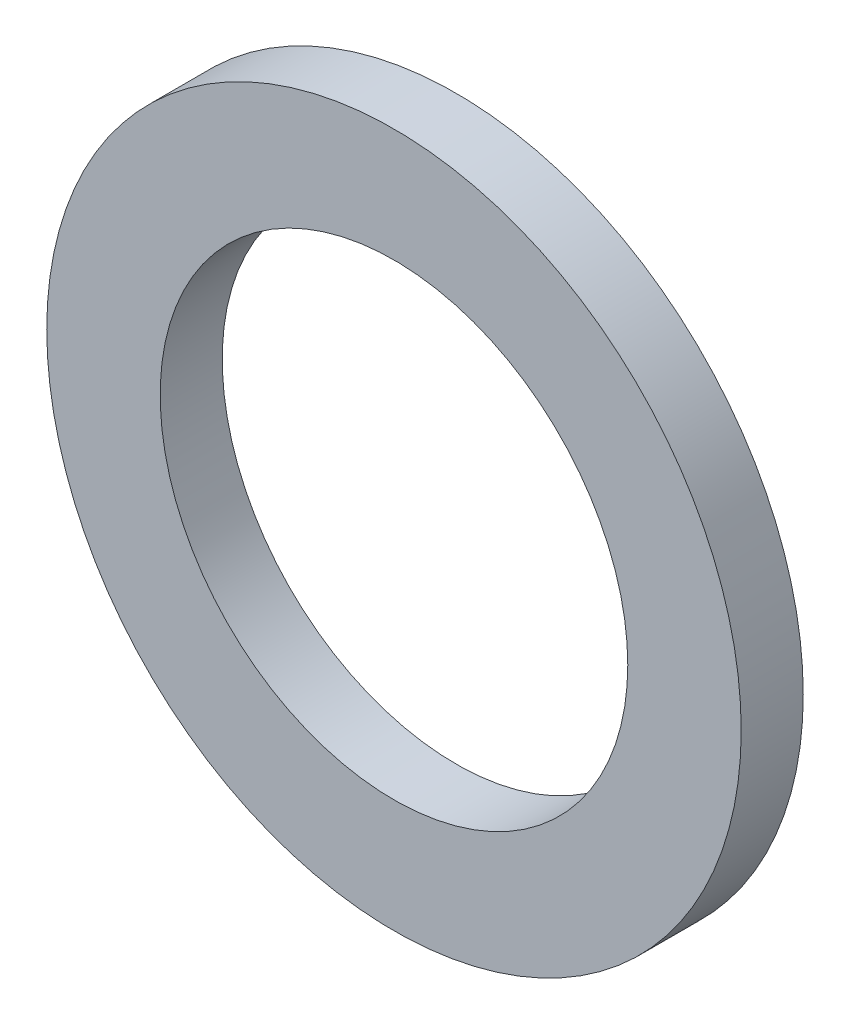
from build123d import *

# Parameters (mm, degrees)
BOSS_EXTRUDE1_DEPTH      = 0.8509
BOSS_EXTRUDE1_DEPTH_BACK = 0.8509
SKETCH3_R                = 9.525
SKETCH3_R_2              = 6.4135


with BuildPart() as part:
    # Sketch3 → Boss-Extrude1 (new, two sides: drawn at the far end of the back side and taken through both)
    with BuildSketch(Plane.XY.offset(-BOSS_EXTRUDE1_DEPTH_BACK)):
        Circle(SKETCH3_R)
        Circle(SKETCH3_R_2, mode=Mode.SUBTRACT)
    extrude(amount=BOSS_EXTRUDE1_DEPTH + BOSS_EXTRUDE1_DEPTH_BACK)


solid = part.part
